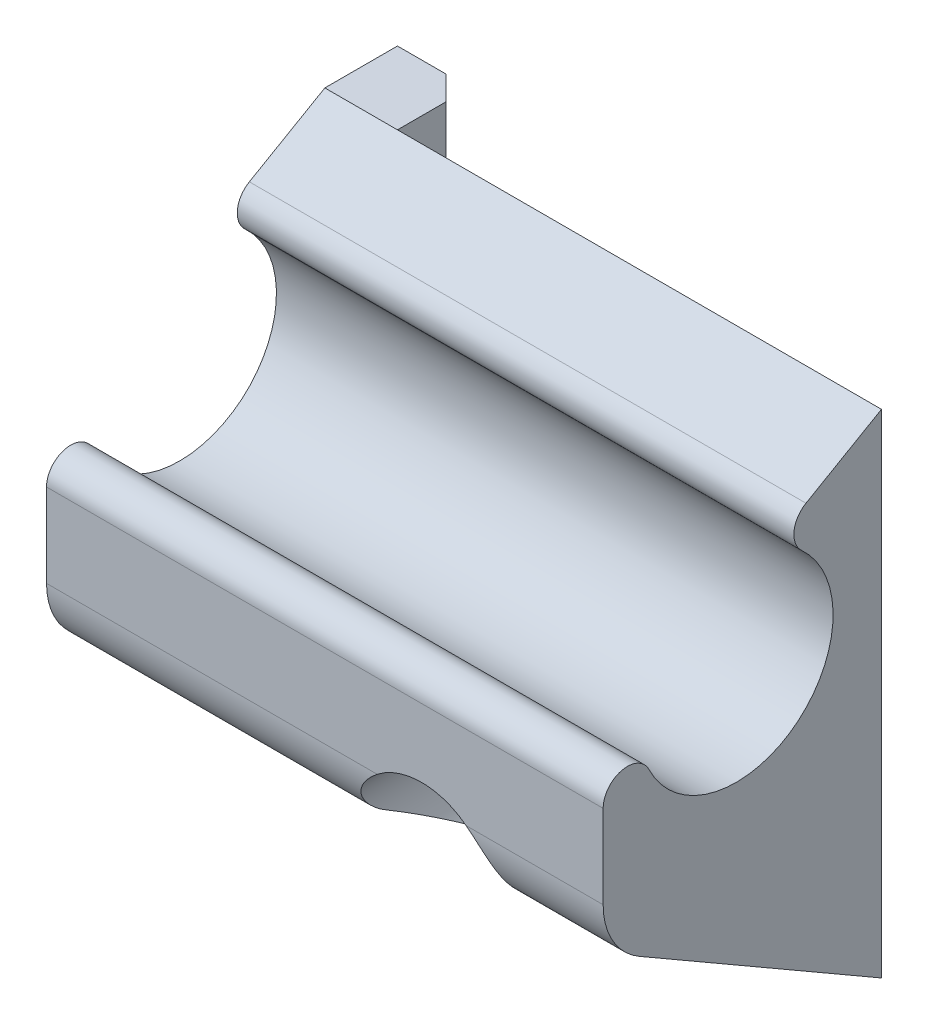
from build123d import *

# Parameters (mm, degrees)
EXTRUDE_1_DEPTH      = 7.5
EXTRUDE_1_DEPTH_BACK = 15.5
SKETCH_2_R           = 1.6
CUT_EXTRUDE_1_DEPTH  = 25.050924737
SKETCH_3_R           = 3
CUT_EXTRUDE_2_DEPTH  = 6
SKETCH_4_W           = 3
SKETCH_4_H           = 20.350852961
EXTRUDE_2_DEPTH      = 3
FILLET_1_R           = 3
CHAMFER_2_SIZE       = 1


with BuildPart() as part:
    # 草图1 → 凸台-拉伸1 (new, two sides: drawn at the far end of the back side and taken through both)
    with BuildSketch(Plane(origin=(0, 0, 0), x_dir=(0, 0, -1), z_dir=(1, 0, 0)).offset(-EXTRUDE_1_DEPTH_BACK)):
        with BuildLine():
            Line((0, 0), (0, 14.350852961))
            Line((0, 14.350852961), (-3.11932209, 12.549911513))
            ThreePointArc((-3.11932209, 12.549911513), (-3.613338081, 11.79312076), (-3.295457672, 10.947108887))
            ThreePointArc((-3.295457672, 10.947108887), (-3.612312045, 4.790802869), (-9.6, 6.256440423))
            ThreePointArc((-9.6, 6.256440423), (-10.723606798, 6.795229963), (-11.5, 5.820550528))
            Line((-11.5, 5.820550528), (-11.5, 0.639528096))
            Line((-11.5, 0.639528096), (0, -6))
            Line((0, -6), (0, 0))
        make_face()
    extrude(amount=EXTRUDE_1_DEPTH + EXTRUDE_1_DEPTH_BACK)

    # 草图2 → 切除-拉伸1 (cut, through all)
    with BuildSketch(Plane.XY.offset(11.5)):
        Circle(SKETCH_2_R)
    extrude(amount=-CUT_EXTRUDE_1_DEPTH, mode=Mode.SUBTRACT)

    # 草图3 → 切除-拉伸2 (cut)
    with BuildSketch(Plane.XY.offset(11.5)):
        Circle(SKETCH_3_R)
    extrude(amount=-CUT_EXTRUDE_2_DEPTH, mode=Mode.SUBTRACT)

    # 草图4 → 凸台-拉伸2 (add)
    with BuildSketch(Plane(origin=(0, 0, 0), x_dir=(-1, 0, 0), z_dir=(0, 0, -1))):
        with Locations((14, 4.175426481)):
            Rectangle(SKETCH_4_W, SKETCH_4_H)
    extrude(amount=EXTRUDE_2_DEPTH)

    # 圆角1
    fillet_1_edges = [part.edges().sort_by_distance(p)[0] for p in [
        (5.215520711, 0.639528096, 11.5),
        (-9.215520711, 0.639528096, 11.5),
    ]]
    fillet(fillet_1_edges, radius=FILLET_1_R)

    # 倒角2
    chamfer_2_edges = [part.edges().sort_by_distance(p)[0] for p in [
        (-12.5, 4.175426481, -3),
    ]]
    chamfer(chamfer_2_edges, length=CHAMFER_2_SIZE)


solid = part.part
